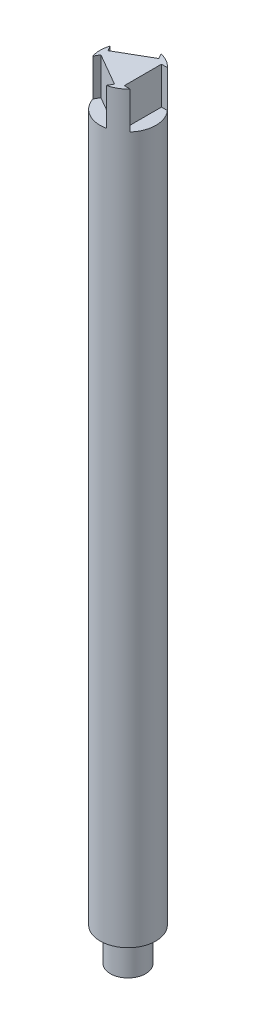
from build123d import *

# Parameters (mm, degrees)
SKETCH1_R           = 4.75
BOSS_EXTRUDE1_DEPTH = 9
SKETCH2_R           = 7.5
BOSS_EXTRUDE2_DEPTH = 200
CUT_EXTRUDE1_START  = 4
SKETCH3_W           = 10
SKETCH3_H           = 10
CUT_EXTRUDE1_DEPTH  = 206.268965688
CIRPATTERN2_COUNT   = 3


with BuildPart() as part:
    # Sketch1 → Boss-Extrude1 (new body)
    with BuildSketch(Plane(origin=(0, 0, 0), x_dir=(1, 0, 0), z_dir=(0, 1, 0))):
        with Locations(Location((0, 0, 0), (0, 0, 270))):
            Circle(SKETCH1_R)
    extrude(amount=BOSS_EXTRUDE1_DEPTH)

    # Sketch2 → Boss-Extrude2 (add)
    with BuildSketch(Plane(origin=(0, 9, 0), x_dir=(1, 0, 0), z_dir=(0, 1, 0))):
        with Locations(Location((0, 0, 0), (0, 0, 270))):
            Circle(SKETCH2_R)
    extrude(amount=BOSS_EXTRUDE2_DEPTH)

    # Sketch3 → Cut-Extrude1 (cut, through all)
    with BuildSketch(Plane(origin=(0, 0, 0), x_dir=(0, 0, -1), z_dir=(1, 0, 0)).offset(CUT_EXTRUDE1_START)):
        with Locations((0, 204)):
            Rectangle(SKETCH3_W, SKETCH3_H)
    cut_extrude1 = extrude(amount=CUT_EXTRUDE1_DEPTH, mode=Mode.SUBTRACT)

    # CirPattern2: Cut-Extrude1 ×3 about axis
    cirpattern2_axis = Axis((0, 0, 0), (0, 1, 0))
    for i in range(1, CIRPATTERN2_COUNT):
        add(cut_extrude1.rotate(cirpattern2_axis, i * 360 / CIRPATTERN2_COUNT), mode=Mode.SUBTRACT)


solid = part.part
